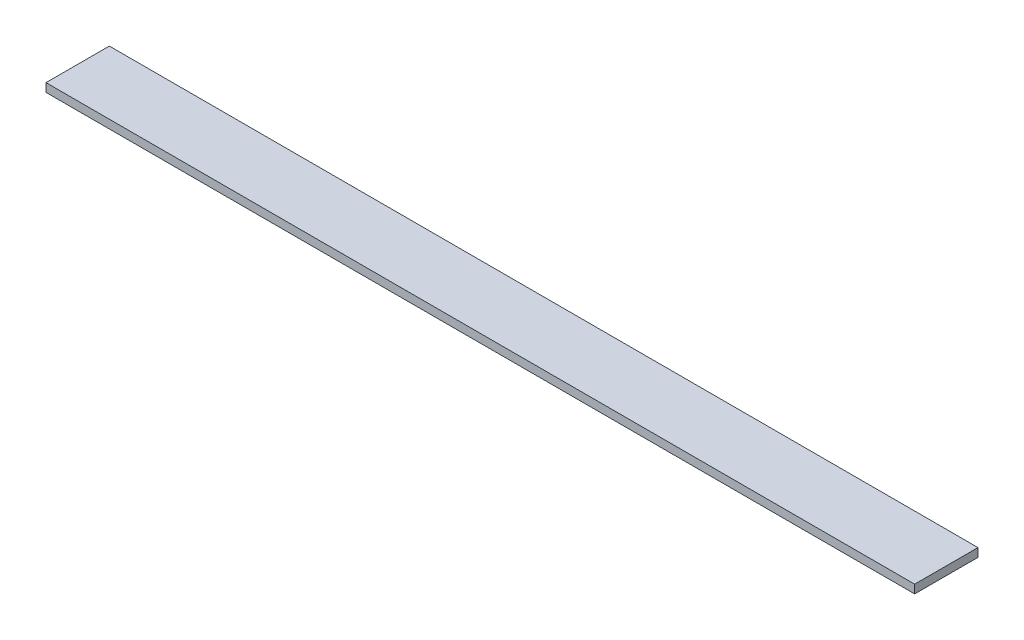
from build123d import *

# Parameters (mm, degrees)
SKETCH1_W           = 1219.2
SKETCH1_H           = 88.9
BOSS_EXTRUDE1_DEPTH = 5.953125


with BuildPart() as part:
    # Sketch1 → Boss-Extrude1 (new, symmetric)
    with BuildSketch(Plane(origin=(0, 0, 0), x_dir=(1, 0, 0), z_dir=(0, 1, 0))):
        Rectangle(SKETCH1_W, SKETCH1_H)
    extrude(amount=BOSS_EXTRUDE1_DEPTH, both=True)


solid = part.part
